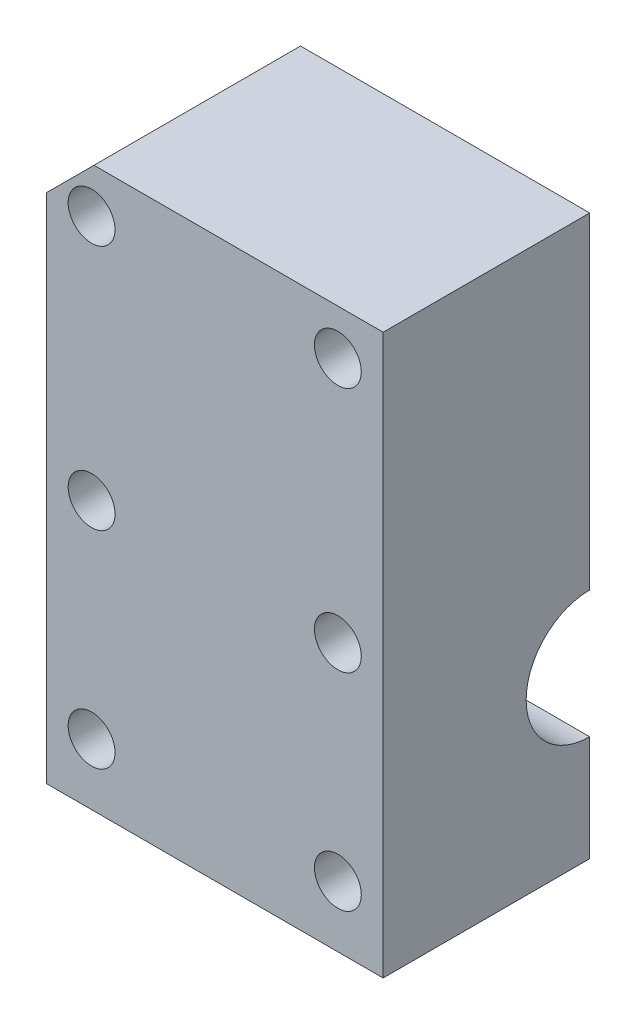
from build123d import *

# Parameters (mm, degrees)
SKETCH2_R           = 2.15
SKETCH2_R_2         = 1.804126588
SKETCH2_R_3         = 2.95
SKETCH2_W           = 9
SKETCH2_H           = 16
BOSS_EXTRUDE1_DEPTH = 3
SKETCH7_W           = 42.4
SKETCH7_H           = 70.4
SKETCH7_R           = 1.804126588
SKETCH7_R_2         = 2.95
BOSS_EXTRUDE4_DEPTH = 18
SKETCH3_W           = 42.4
SKETCH3_H           = 70.4
BOSS_EXTRUDE2_DEPTH = 5
CUT_EXTRUDE1_START  = -20
SKETCH4_R           = 2.95
CUT_EXTRUDE1_DEPTH  = 20
CUT_EXTRUDE2_REACH  = 71.96
SKETCH5_R           = 8
CUT_EXTRUDE3_START  = -11
SKETCH8_R           = 10.5
CUT_EXTRUDE3_DEPTH  = 2
CUT_EXTRUDE4_START  = -37.4
SKETCH8_2_R         = 10.5
CUT_EXTRUDE4_DEPTH  = 4.680146
CHAMFER1_SIZE       = 6
SKETCH6_R           = 3.95
BOSS_EXTRUDE3_DEPTH = 3
CHAMFER2_SIZE       = 0.25


with BuildPart() as part:
    # Sketch2 → Boss-Extrude1 (new body)
    # profile 1 of 4: a face of its own
    with BuildSketch(Plane.XY):
        with BuildLine():
            Line((21.2, -35.9), (12.2, -35.9))
            Line((12.2, -35.9), (12.2, -38.4))
            Line((12.2, -38.4), (12.2, -48.1))
            Line((12.2, -48.1), (-11.95, -48.1))
            Line((-11.95, -48.1), (-11.95, -40.891869727))
            Line((-11.95, -40.891869727), (-16.2, -37.241869727))
            Line((-16.2, -37.241869727), (-16.2, -19.819444087))
            Line((-16.2, -19.819444087), (-12.2, -15.659508007))
            Line((-12.2, -15.659508007), (-12.2, -14.172155799))
            ThreePointArc((-12.2, -14.172155799), (0, 18.7), (12.2, -14.172155799))
            Line((12.2, -14.172155799), (12.2, -17.4))
            Line((12.2, -17.4), (12.2, -19.9))
            Line((12.2, -19.9), (21.2, -19.9))
            Line((21.2, -19.9), (21.2, 21.2))
            Line((21.2, 21.2), (-13.2, 21.2))
            Line((-13.2, 21.2), (-21.2, 21.2))
            Line((-21.2, 21.2), (-21.2, -49.2))
            Line((-21.2, -49.2), (-9, -49.2))
            Line((-9, -49.2), (11.2, -49.2))
            Line((11.2, -49.2), (21.2, -49.2))
            Line((21.2, -49.2), (21.2, -35.9))
        make_face()
        with Locations((-15.5, -41.5)):
            Circle(SKETCH2_R, mode=Mode.SUBTRACT)
        with Locations((15.5, -41.5)):
            Circle(SKETCH2_R, mode=Mode.SUBTRACT)
        with Locations((-15.5, -15.5)):
            Circle(SKETCH2_R_2, mode=Mode.SUBTRACT)
        with Locations((-15.5, 15.5)):
            Circle(SKETCH2_R_3, mode=Mode.SUBTRACT)
        with Locations((15.5, -15.5)):
            Circle(SKETCH2_R_2, mode=Mode.SUBTRACT)
        with Locations((15.5, 15.5)):
            Circle(SKETCH2_R_3, mode=Mode.SUBTRACT)
    # profile 2 of 4: a face of its own
    with BuildSketch(Plane.XY):
        with Locations((16.7, -27.9)):
            Rectangle(SKETCH2_W, SKETCH2_H)
    # profile 3 of 4: a face of its own
    with BuildSketch(Plane.XY):
        with Locations((-15.5, -41.5)):
            Circle(SKETCH2_R)
        with Locations((-15.5, -41.5)):
            Circle(SKETCH2_R_2, mode=Mode.SUBTRACT)
    # profile 4 of 4: a face of its own
    with BuildSketch(Plane.XY):
        with Locations((15.5, -41.5)):
            Circle(SKETCH2_R)
        with Locations((15.5, -41.5)):
            Circle(SKETCH2_R_2, mode=Mode.SUBTRACT)
    extrude(amount=BOSS_EXTRUDE1_DEPTH)

    # Sketch7 → Boss-Extrude4 (add)
    with BuildSketch(Plane.XY.offset(3)):
        with Locations((0, -14)):
            Rectangle(SKETCH7_W, SKETCH7_H)
        with Locations((15.5, -41.5)):
            Circle(SKETCH7_R, mode=Mode.SUBTRACT)
        with Locations((-15.5, -41.5)):
            Circle(SKETCH7_R, mode=Mode.SUBTRACT)
        with Locations((-15.5, -15.5)):
            Circle(SKETCH7_R, mode=Mode.SUBTRACT)
        with Locations((15.5, -15.5)):
            Circle(SKETCH7_R, mode=Mode.SUBTRACT)
        with Locations((15.5, 15.5)):
            Circle(SKETCH7_R_2, mode=Mode.SUBTRACT)
        with Locations((-15.5, 15.5)):
            Circle(SKETCH7_R_2, mode=Mode.SUBTRACT)
        with BuildLine():
            Line((10.2, -46.1), (10.2, -13.223085873))
            ThreePointArc((10.2, -13.223085873), (0, 16.7), (-10.2, -13.223085873))
            Line((-10.2, -13.223085873), (-10.2, -16.465067137))
            Line((-10.2, -16.465067137), (-14.2, -20.625003217))
            Line((-14.2, -20.625003217), (-14.2, -36.323172457))
            Line((-14.2, -36.323172457), (-9.95, -39.973172457))
            Line((-9.95, -39.973172457), (-9.95, -46.1))
            Line((-9.95, -46.1), (10.2, -46.1))
        make_face(mode=Mode.SUBTRACT)
    extrude(amount=BOSS_EXTRUDE4_DEPTH)

    # Sketch3 → Boss-Extrude2 (add)
    with BuildSketch(Plane.XY.offset(21)):
        with Locations((0, -14)):
            Rectangle(SKETCH3_W, SKETCH3_H)
    extrude(amount=BOSS_EXTRUDE2_DEPTH)

    # Sketch4 → Cut-Extrude1 (cut)
    with BuildSketch(Plane.XY.offset(26).offset(CUT_EXTRUDE1_START)):
        with Locations((-15.5, -15.5)):
            Circle(SKETCH4_R)
        with Locations((15.5, -15.5)):
            Circle(SKETCH4_R)
        with Locations((-15.5, -41.5)):
            Circle(SKETCH4_R)
        with Locations((15.5, -41.5)):
            Circle(SKETCH4_R)
        with Locations((-15.5, 15.5)):
            Circle(SKETCH4_R)
        with Locations((15.5, 15.5)):
            Circle(SKETCH4_R)
    extrude(amount=CUT_EXTRUDE1_DEPTH, mode=Mode.SUBTRACT)

    # Sketch5 → Cut-Extrude2 (cut, up to next)
    with BuildSketch(Plane(origin=(21.2, 0, 0), x_dir=(0, 0, -1), z_dir=(1, 0, 0)), mode=Mode.PRIVATE) as cut_extrude2_sk1:
        with Locations((0, -27.9)):
            Circle(SKETCH5_R)
    cut_extrude2_tool1 = extrude(cut_extrude2_sk1.sketch, amount=-CUT_EXTRUDE2_REACH, mode=Mode.PRIVATE) & part.part
    add(cut_extrude2_tool1.solids().sort_by_distance((21.2, -27.9, 0))[0], mode=Mode.SUBTRACT)

    # Sketch8 → Cut-Extrude3 (cut)
    with BuildSketch(Plane(origin=(21.2, 0, 0), x_dir=(0, 0, -1), z_dir=(1, 0, 0)).offset(CUT_EXTRUDE3_START)):
        with Locations((0, -27.9)):
            Circle(SKETCH8_R)
    extrude(amount=CUT_EXTRUDE3_DEPTH, mode=Mode.SUBTRACT)

    # Sketch8<2> → Cut-Extrude4 (cut)
    with BuildSketch(Plane(origin=(21.2, 0, 0), x_dir=(0, 0, -1), z_dir=(1, 0, 0)).offset(CUT_EXTRUDE4_START)):
        with Locations((0, -27.9)):
            Circle(SKETCH8_2_R)
    extrude(amount=CUT_EXTRUDE4_DEPTH, mode=Mode.SUBTRACT)

    # Chamfer1
    chamfer1_edges = [part.edges().sort_by_distance(p)[0] for p in [
        (-21.2, 21.2, 13),
    ]]
    chamfer(chamfer1_edges, length=CHAMFER1_SIZE)

    # Sketch6 → Boss-Extrude3 (add)
    with BuildSketch(Plane(origin=(0, 0, 21), x_dir=(-1, 0, 0), z_dir=(0, 0, -1))):
        with Locations(Location((0, 0, 0), (0, 0, 180))):
            Circle(SKETCH6_R)
    extrude(amount=BOSS_EXTRUDE3_DEPTH)

    # Chamfer2
    chamfer2_edges = [part.edges().sort_by_distance(p)[0] for p in [
        (-3.95, 0, 18),
    ]]
    chamfer(chamfer2_edges, length=CHAMFER2_SIZE)


solid = part.part
